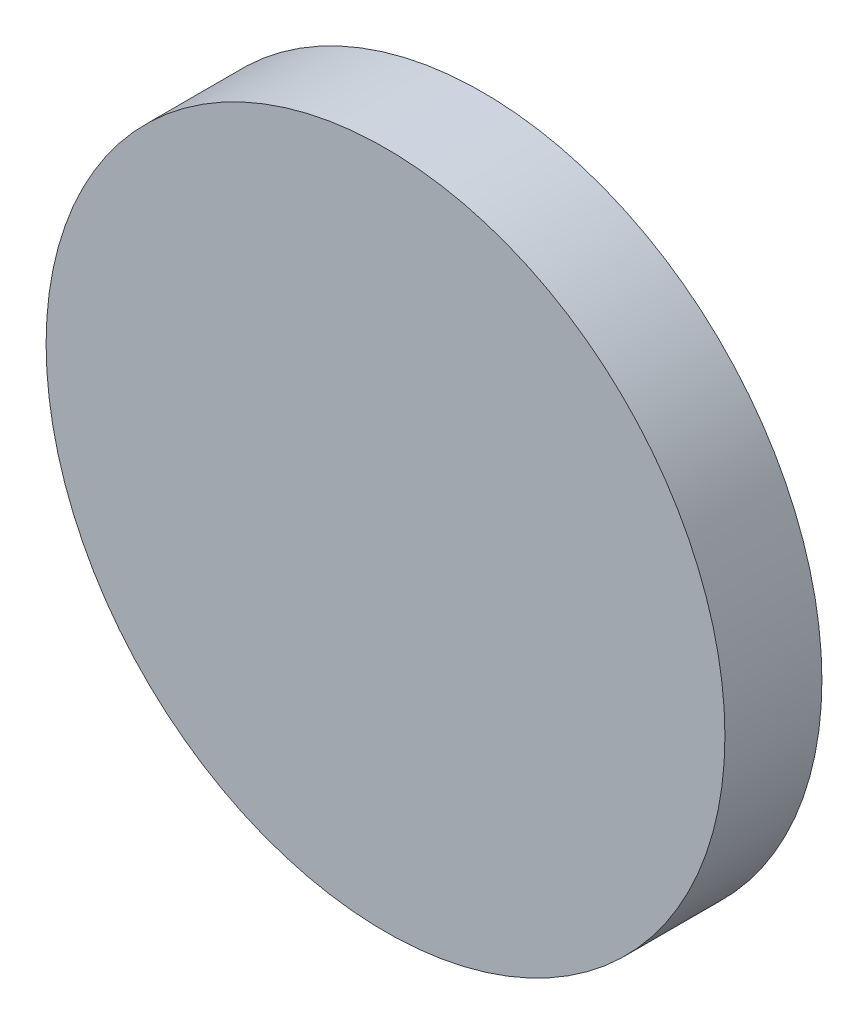
from build123d import *

# Parameters (mm, degrees)
ESQUISSE1_R        = 1.4
BOSS_EXTRU_1_DEPTH = 0.4


with BuildPart() as part:
    # Esquisse1 → Boss.-Extru.1 (new body)
    with BuildSketch(Plane.XY):
        Circle(ESQUISSE1_R)
    extrude(amount=BOSS_EXTRU_1_DEPTH)


solid = part.part
